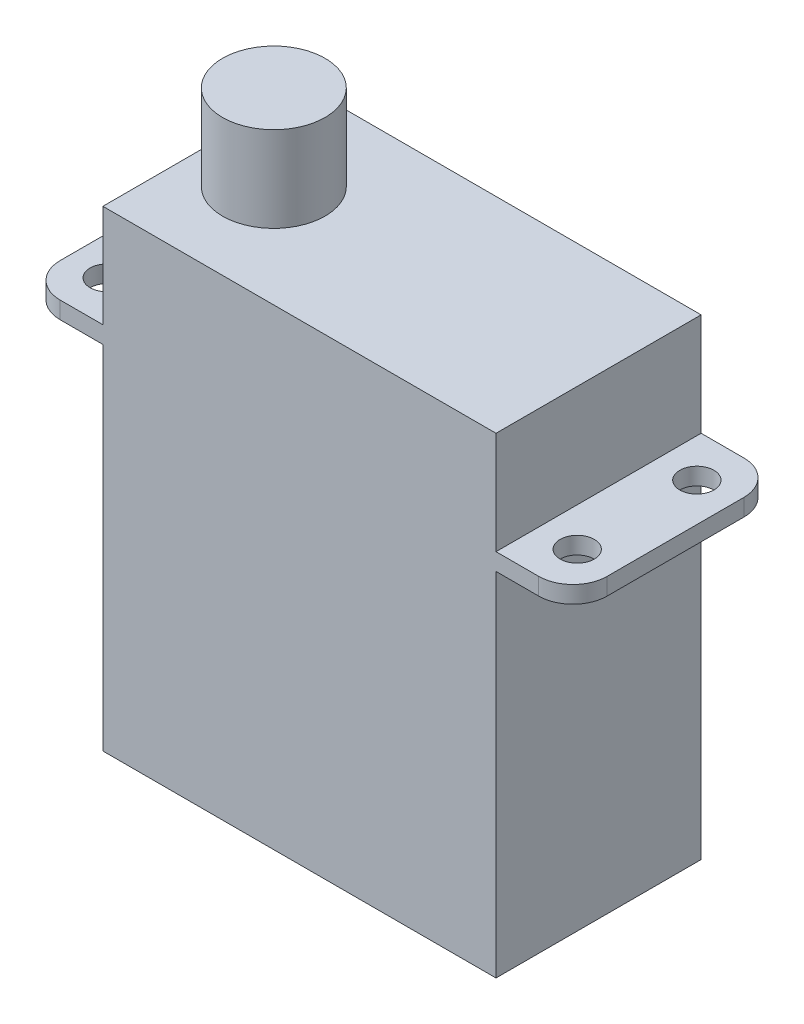
from build123d import *

# Parameters (mm, degrees)
SKETCH_1_W               = 23
SKETCH_1_H               = 27.6
SKETCH_1_W_2             = 4.5
SKETCH_1_H_2             = 1
EXTRUDE_1_DEPTH          = 6
SKETCH_2_R               = 3
EXTRUDE_2_DEPTH          = 5
CUT_EXTRUDE_1_DEPTH      = 28.541967976
CUT_EXTRUDE_1_DEPTH_BACK = 28.541967976
SKETCH_3_R               = 1
FILLET_1_R               = 2


with BuildPart() as part:
    # Эскиз1 → Бобышка-Вытянуть1 (new, symmetric)
    with BuildSketch(Plane.XY):
        Rectangle(SKETCH_1_W, SKETCH_1_H)
        with Locations((-13.75, 7.3)):
            Rectangle(SKETCH_1_W_2, SKETCH_1_H_2)
        with Locations((13.75, 7.3)):
            Rectangle(SKETCH_1_W_2, SKETCH_1_H_2)
    extrude(amount=EXTRUDE_1_DEPTH, both=True)

    # Эскиз2 → Бобышка-Вытянуть2 (add)
    with BuildSketch(Plane(origin=(0, 13.8, 0), x_dir=(1, 0, 0), z_dir=(0, 1, 0))):
        with Locations(Location((-7.5, 0, 0), (0, 0, 270))):
            Circle(SKETCH_2_R)
    extrude(amount=EXTRUDE_2_DEPTH)

    # Эскиз3 → Вырез-Вытянуть1 (cut, two sides: drawn at the far end of the back side and taken through both)
    with BuildSketch(Plane(origin=(0, 7.8, 0), x_dir=(1, 0, 0), z_dir=(0, 1, 0)).offset(-CUT_EXTRUDE_1_DEPTH_BACK)):
        with Locations(Location((-13.75, 3.5, 0), (0, 0, 180))):
            Circle(SKETCH_3_R)
        with Locations(Location((-13.75, -3.5, 0), (0, 0, 180))):
            Circle(SKETCH_3_R)
        with Locations(Location((13.75, -3.5, 0), (0, 0, 180))):
            Circle(SKETCH_3_R)
        with Locations(Location((13.75, 3.5, 0), (0, 0, 180))):
            Circle(SKETCH_3_R)
    extrude(amount=CUT_EXTRUDE_1_DEPTH + CUT_EXTRUDE_1_DEPTH_BACK, mode=Mode.SUBTRACT)

    # Скругление1
    fillet_1_edges = [part.edges().sort_by_distance(p)[0] for p in [
        (-16, 7.3, -6),
        (16, 7.3, -6),
        (16, 7.3, 6),
        (-16, 7.3, 6),
    ]]
    fillet(fillet_1_edges, radius=FILLET_1_R)


solid = part.part
